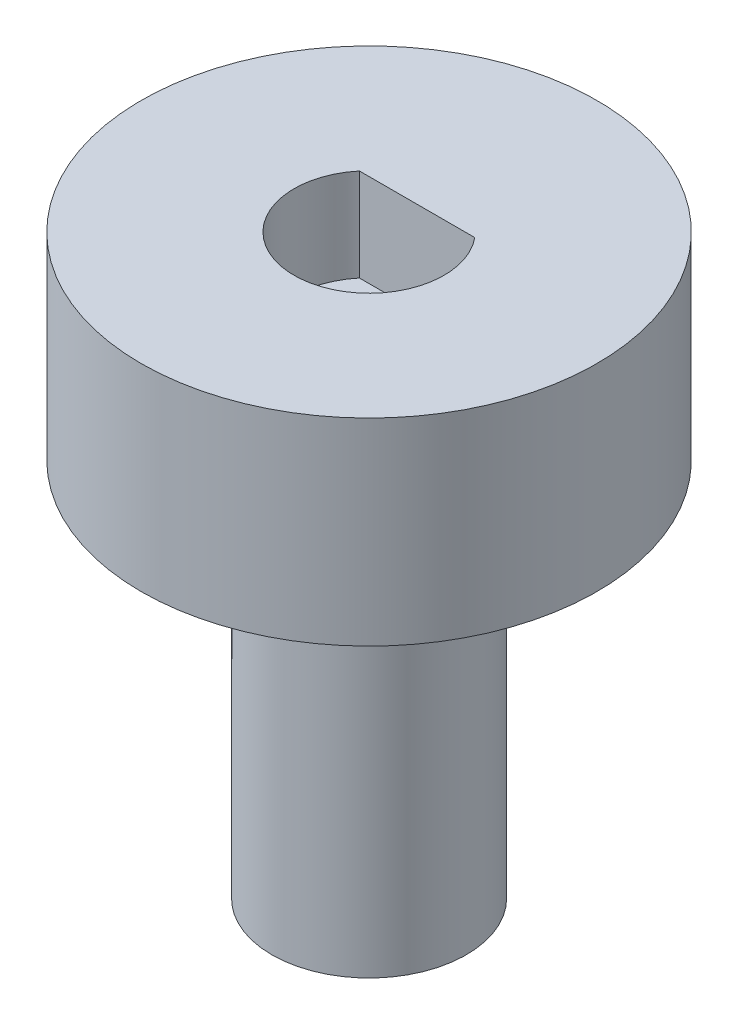
from build123d import *

# Parameters (mm, degrees)
SKETCH2_R           = 4.066
BOSS_EXTRUDE1_DEPTH = 15.875
SKETCH3_R           = 9.525
BOSS_EXTRUDE2_DEPTH = 8.255
CUT_EXTRUDE1_DEPTH  = 3.875


with BuildPart() as part:
    # Sketch2 → Boss-Extrude1 (new body)
    with BuildSketch(Plane(origin=(0, 0, 0), x_dir=(1, 0, 0), z_dir=(0, 1, 0))):
        with Locations(Location((0, 0, 0), (0, 0, 270))):
            Circle(SKETCH2_R)
    extrude(amount=BOSS_EXTRUDE1_DEPTH)

    # Sketch3 → Boss-Extrude2 (add)
    with BuildSketch(Plane(origin=(0, 15.875, 0), x_dir=(1, 0, 0), z_dir=(0, 1, 0))):
        with Locations(Location((0, 0, 0), (0, 0, 270))):
            Circle(SKETCH3_R)
    extrude(amount=BOSS_EXTRUDE2_DEPTH)

    # Sketch4 → Cut-Extrude1 (cut)
    with BuildSketch(Plane(origin=(0, 24.13, 0), x_dir=(1, 0, 0), z_dir=(0, 1, 0))):
        with BuildLine():
            Line((-2.41031525, 2.007616), (2.41031525, 2.007616))
            ThreePointArc((2.41031525, 2.007616), (0, -3.1369), (-2.41031525, 2.007616))
        make_face()
    extrude(amount=-CUT_EXTRUDE1_DEPTH, mode=Mode.SUBTRACT)


solid = part.part
